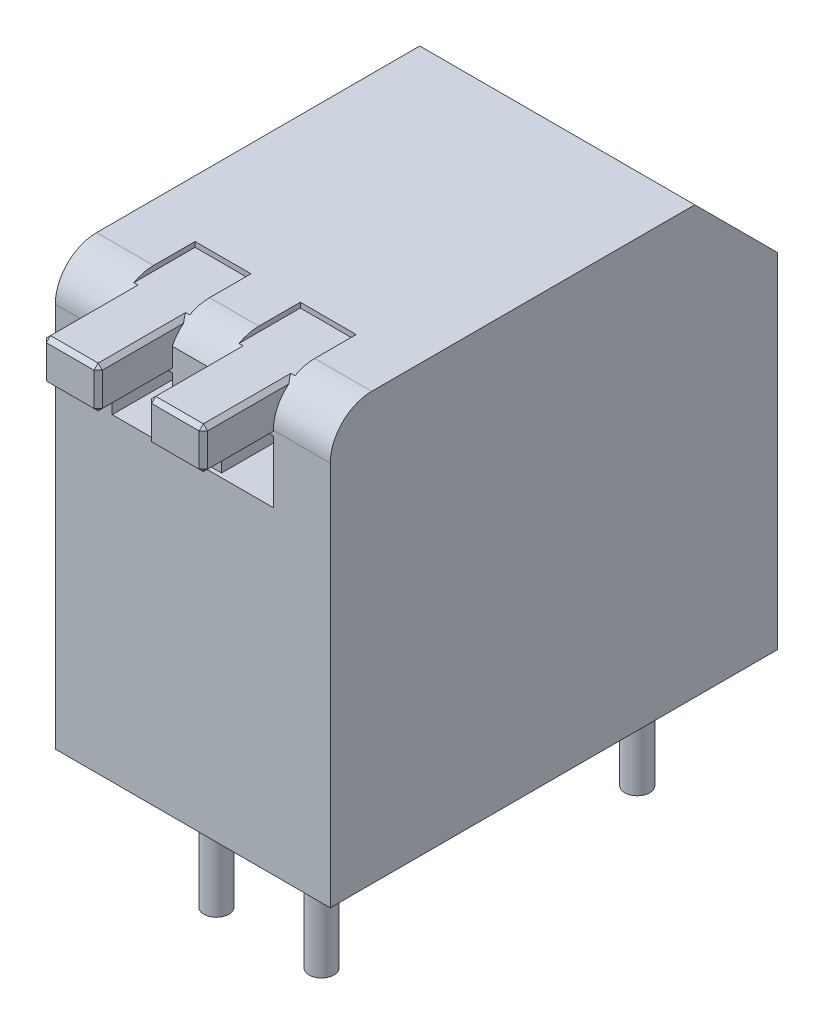
from build123d import *

# Parameters (mm, degrees)
SKETCH_1_W          = 10.8
SKETCH_1_H          = 10.3
EXTRUDE_1_DEPTH     = 6.64
CHAMFER_1_SIZE      = 2
SKETCH_2_R          = 0.3
EXTRUDE_2_DEPTH     = 3.2
FILLET_1_R          = 1
SKETCH_3_W          = 1.35
SKETCH_3_H          = 2.620478626
CUT_EXTRUDE_1_DEPTH = 2
SKETCH_4_W          = 3.89
SKETCH_4_H          = 2.620478626
CUT_EXTRUDE_2_DEPTH = 0.1
SKETCH_5_W          = 1.35
SKETCH_5_H          = 1
EXTRUDE_3_DEPTH     = 3.69
CHAMFER_2_SIZE      = 0.1


with BuildPart() as part:
    # Эскиз1 → Вытянуть1 (new body)
    with BuildSketch(Plane(origin=(0, 0, 0), x_dir=(0, 0, -1), z_dir=(1, 0, 0))):
        Rectangle(SKETCH_1_W, SKETCH_1_H)
    extrude(amount=EXTRUDE_1_DEPTH)

    # Фаска1
    chamfer_1_edges = [part.edges().sort_by_distance(p)[0] for p in [
        (3.32, 5.15, -5.4),
    ]]
    chamfer(chamfer_1_edges, length=CHAMFER_1_SIZE)

    # Эскиз2 → Вытянуть2 (add)
    with BuildSketch(Plane.XZ.offset(5.15)):
        with Locations(Location((2.05, 3.56, 0), (0, 0, 90))):
            Circle(SKETCH_2_R)
        with Locations(Location((4.59, 3.56, 0), (0, 0, 90))):
            Circle(SKETCH_2_R)
        with Locations(Location((2.05, -4.06, 0), (0, 0, 90))):
            Circle(SKETCH_2_R)
        with Locations(Location((4.59, -4.06, 0), (0, 0, 90))):
            Circle(SKETCH_2_R)
    extrude(amount=EXTRUDE_2_DEPTH)

    # Скругление1
    fillet_1_edges = [part.edges().sort_by_distance(p)[0] for p in [
        (3.32, 5.15, 5.4),
    ]]
    fillet(fillet_1_edges, radius=FILLET_1_R)

    # Эскиз3 → Вырез-Вытянуть1 (cut)
    with BuildSketch(Plane.XY.offset(5.4)):
        with Locations((2.05, 3.839760687)):
            Rectangle(SKETCH_3_W, SKETCH_3_H)
        with Locations((4.59, 3.839760687)):
            Rectangle(SKETCH_3_W, SKETCH_3_H)
    extrude(amount=-CUT_EXTRUDE_1_DEPTH, mode=Mode.SUBTRACT)

    # Эскиз4 → Вырез-Вытянуть2 (cut)
    with BuildSketch(Plane.XY.offset(5.4)):
        with Locations((3.32, 3.839760687)):
            Rectangle(SKETCH_4_W, SKETCH_4_H)
    extrude(amount=-CUT_EXTRUDE_2_DEPTH, mode=Mode.SUBTRACT)

    # Эскиз5 → Вытянуть3 (add)
    with BuildSketch(Plane.XY.offset(3.4)):
        with Locations((2.05, 4.528321525)):
            Rectangle(SKETCH_5_W, SKETCH_5_H)
        with Locations((4.59, 4.528321525)):
            Rectangle(SKETCH_5_W, SKETCH_5_H)
    extrude(amount=EXTRUDE_3_DEPTH)

    # Фаска2
    chamfer_2_edges = [part.edges().sort_by_distance(p)[0] for p in [
        (1.375, 5.028321525, 5.984035196),
        (1.375, 4.028321525, 6.245),
        (2.725, 4.028321525, 6.195),
        (2.725, 5.028321525, 5.984035196),
        (1.375, 4.528321525, 7.09),
        (2.05, 4.028321525, 7.09),
        (2.725, 4.528321525, 7.09),
        (2.05, 5.028321525, 7.09),
        (5.265, 4.028321525, 6.245),
        (3.915, 5.028321525, 5.984035196),
        (3.915, 4.028321525, 6.195),
        (5.265, 5.028321525, 5.984035196),
        (3.915, 4.528321525, 7.09),
        (4.59, 4.028321525, 7.09),
        (5.265, 4.528321525, 7.09),
        (4.59, 5.028321525, 7.09),
    ]]
    chamfer(chamfer_2_edges, length=CHAMFER_2_SIZE)


solid = part.part
